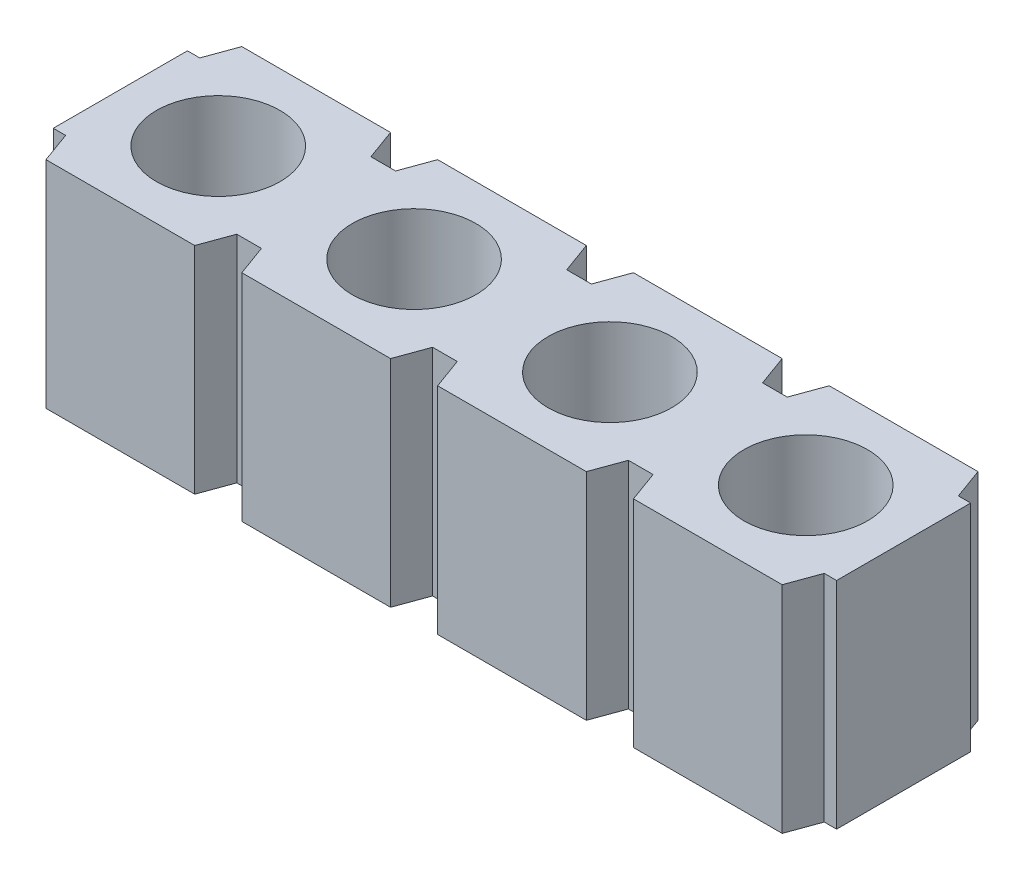
from build123d import *

# Parameters (mm, degrees)
EXTRUDE1_DEPTH  = 2.794
HOLE1_D         = 1.60274
EXTRUDE2_DEPTH  = 2.794
LPATTERN1_COUNT = 4
LPATTERN1_PITCH = 2.54
LPATTERN2_COUNT = 63
LPATTERN2_PITCH = 2.54


with BuildPart() as part:
    # Sketch1 → Extrude1 (new body)
    with BuildSketch(Plane(origin=(0, 0, 0), x_dir=(1, 0, 0), z_dir=(0, 1, 0))):
        Polygon((9.854373708, 0.40005), (9.694353708, 0.40005), (9.548747416, 0), (0, 0), (-0.145606292, 0.40005), (-0.305626292, 0.40005), (-0.305626292, 2.13995), (-0.145606292, 2.13995), (0, 2.54), (9.548747416, 2.54), (9.694353708, 2.13995), (9.854373708, 2.13995), align=None)
    extrude(amount=-EXTRUDE1_DEPTH)

    # Hole1 (through all)
    with Locations(Plane(origin=(0.964373708, 0, -1.27), x_dir=(0, 0, 1), z_dir=(0, 1, 0))):
        with Locations((0, 0)):
            hole1 = Hole(HOLE1_D / 2)

    # Sketch4 → Extrude2 (cut)
    with BuildSketch(Plane(origin=(0, 0, 0), x_dir=(1, 0, 0), z_dir=(0, 1, 0))):
        Polygon((1.928772816, 0), (2.5399746, 0), (2.394368308, 0.40005), (2.074379108, 0.40005), align=None)
        Polygon((2.074379108, 2.13995), (2.394368308, 2.13995), (2.5399746, 2.54), (1.928772816, 2.54), align=None)
    extrude2 = extrude(amount=-EXTRUDE2_DEPTH, mode=Mode.SUBTRACT)

    # LPattern1: Hole1 ×4
    with Locations(*[(i * LPATTERN1_PITCH, 0, 0) for i in range(1, LPATTERN1_COUNT)]):
        add(hole1, mode=Mode.SUBTRACT)

    # LPattern2: Extrude2 ×63
    with Locations(*[(i * LPATTERN2_PITCH, 0, 0) for i in range(1, LPATTERN2_COUNT)]):
        add(extrude2, mode=Mode.SUBTRACT)


solid = part.part
